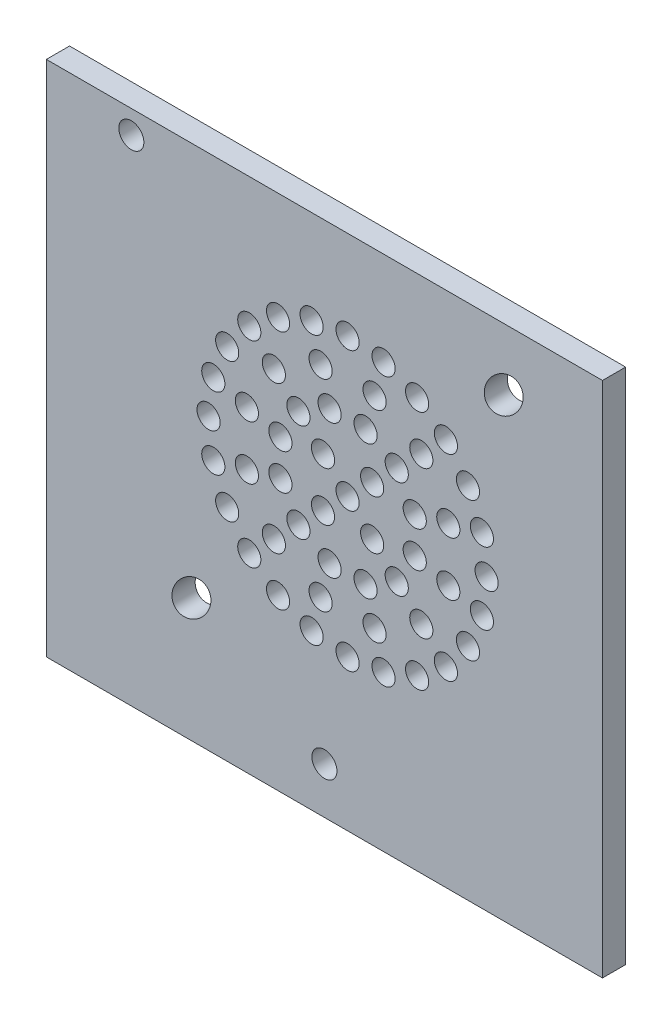
from build123d import *

# Parameters (mm, degrees)
CROQUIS1_W              = 72
CROQUIS1_H              = 67
SALIENTE_EXTRUIR1_DEPTH = 3
CROQUIS3_R              = 1.625
CROQUIS3_R_2            = 1.5
CROQUIS3_RX             = 3
CROQUIS3_RY             = 2
CORTAR_EXTRUIR1_DEPTH   = 3


with BuildPart() as part:
    # Croquis1 → Saliente-Extruir1 (new body)
    with BuildSketch(Plane.XY):
        with Locations((122.25, -8.443705264)):
            Rectangle(CROQUIS1_W, CROQUIS1_H)
    extrude(amount=SALIENTE_EXTRUIR1_DEPTH)

    # Croquis3 → Cortar-Extruir1 (cut)
    with BuildSketch(Plane(origin=(0, 0, 0), x_dir=(-1, 0, 0), z_dir=(0, 0, -1))):
        with Locations((-122.25, -35.943705264)):
            Circle(CROQUIS3_R)
        with Locations((-97.25, 22.056294736)):
            Circle(CROQUIS3_R)
        with Locations((-137.977922061, 8.284216797)):
            Circle(CROQUIS3_R_2)
        with Locations((-129.908742812, 12.942959609)):
            Circle(CROQUIS3_R_2)
        with Locations((-134.25, 11.144752004)):
            Circle(CROQUIS3_R_2)
        with Locations((-128.744057109, 8.596293391)):
            Circle(CROQUIS3_R_2)
        with Locations((-125.25, 13.556294736)):
            Circle(CROQUIS3_R_2)
        with Locations((-120.591257188, 12.942959609)):
            Circle(CROQUIS3_R_2)
        with Locations((-121.755942891, 8.596293391)):
            Circle(CROQUIS3_R_2)
        with Locations((-116.25, 11.144752004)):
            Circle(CROQUIS3_R_2)
        with Locations((-112.522077939, 8.284216797)):
            Circle(CROQUIS3_R_2)
        with Locations((-115.704058454, 5.102236282)):
            Circle(CROQUIS3_R_2)
        with Locations((-109.661542732, 4.556294736)):
            Circle(CROQUIS3_R_2)
        with Locations((-107.25, -4.443705264)):
            Circle(CROQUIS3_R_2)
        with Locations((-107.863335127, 0.215037548)):
            Circle(CROQUIS3_R_2)
        with Locations((-112.210001345, -0.949648155)):
            Circle(CROQUIS3_R_2)
        with Locations((-116.556667563, -2.114333858)):
            Circle(CROQUIS3_R_2)
        with Locations((-118.886038969, 1.920255767)):
            Circle(CROQUIS3_R_2)
        with Locations((-122.068019485, -1.261724749)):
            Circle(CROQUIS3_R_2)
        with Locations((-122.920628594, 4.249627173)):
            Circle(CROQUIS3_R_2)
        with Locations((-127.579371406, 4.249627173)):
            Circle(CROQUIS3_R_2)
        with Locations((-131.613961031, 1.920255767)):
            Circle(CROQUIS3_R_2)
        with Locations((-128.431980515, -1.261724749)):
            Circle(CROQUIS3_R_2)
        with Locations((-134.795941546, 5.102236282)):
            Circle(CROQUIS3_R_2)
        with Locations((-140.838457268, 4.556294736)):
            Circle(CROQUIS3_R_2)
        with Locations((-143.25, -4.443705264)):
            Circle(CROQUIS3_R_2)
        with Locations((-142.636664873, 0.215037548)):
            Circle(CROQUIS3_R_2)
        with Locations((-138.289998655, -0.949648155)):
            Circle(CROQUIS3_R_2)
        with Locations((-133.943332437, -2.114333858)):
            Circle(CROQUIS3_R_2)
        with Locations((-133.943332437, -6.77307667)):
            Circle(CROQUIS3_R_2)
        with Locations((-125.25, -4.443705264)):
            Circle(CROQUIS3_R_2)
        with Locations((-128.431980515, -7.625685779)):
            Circle(CROQUIS3_R_2)
        with Locations((-122.068019485, -7.625685779)):
            Circle(CROQUIS3_R_2)
        with Locations((-116.556667563, -6.77307667)):
            Circle(CROQUIS3_R_2)
        with Locations((-107.863335127, -9.102448076)):
            Circle(CROQUIS3_R_2)
        with Locations((-112.210001345, -7.937762373)):
            Circle(CROQUIS3_R_2)
        with Locations((-109.661542732, -13.443705264)):
            Circle(CROQUIS3_R_2)
        with Locations((-112.522077939, -17.171627325)):
            Circle(CROQUIS3_R_2)
        with Locations((-118.886038969, -10.807666295)):
            Circle(CROQUIS3_R_2)
        with Locations((-127.579371406, -13.137037701)):
            Circle(CROQUIS3_R_2)
        with Locations((-122.920628594, -13.137037701)):
            Circle(CROQUIS3_R_2)
        with Locations((-115.704058454, -13.98964681)):
            Circle(CROQUIS3_R_2)
        with Locations((-121.755942891, -17.483703919)):
            Circle(CROQUIS3_R_2)
        with Locations((-116.25, -20.032162532)):
            Circle(CROQUIS3_R_2)
        with Locations((-120.591257188, -21.830370137)):
            Circle(CROQUIS3_R_2)
        with Locations((-125.25, -22.443705264)):
            Circle(CROQUIS3_R_2)
        with Locations((-128.744057109, -17.483703919)):
            Circle(CROQUIS3_R_2)
        with Locations((-131.613961031, -10.807666295)):
            Circle(CROQUIS3_R_2)
        with Locations((-134.795941546, -13.98964681)):
            Circle(CROQUIS3_R_2)
        with Locations((-138.289998655, -7.937762373)):
            Circle(CROQUIS3_R_2)
        with Locations((-142.636664873, -9.102448076)):
            Circle(CROQUIS3_R_2)
        with Locations((-140.838457268, -13.443705264)):
            Circle(CROQUIS3_R_2)
        with Locations((-137.977922061, -17.171627325)):
            Circle(CROQUIS3_R_2)
        with Locations((-134.25, -20.032162532)):
            Circle(CROQUIS3_R_2)
        with Locations((-129.908742812, -21.830370137)):
            Circle(CROQUIS3_R_2)
        with Locations(Location((-145.464659991, 17.041580897), (0, 0, -46.745301972))):
            Ellipse(CROQUIS3_RX, CROQUIS3_RY)
        with Locations(Location((-105.035340009, -25.928991425), (0, 0, -46.745301972))):
            Ellipse(CROQUIS3_RX, CROQUIS3_RY)
    extrude(amount=-CORTAR_EXTRUIR1_DEPTH, mode=Mode.SUBTRACT)


solid = part.part
